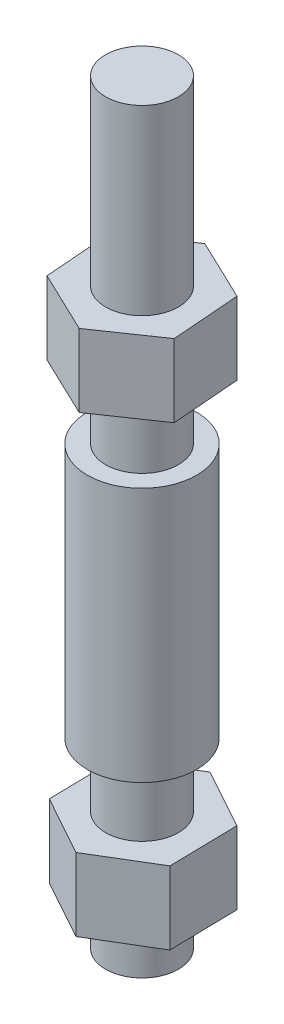
from build123d import *

# Parameters (mm, degrees)
IZIM1_R                     = 4
Y_KSEKLIK_EKSTR_ZYON1_DEPTH = 20
IZIM2_R                     = 6
Y_KSEKLIK_EKSTR_ZYON2_DEPTH = 28
IZIM3_R                     = 4
Y_KSEKLIK_EKSTR_ZYON3_DEPTH = 35
Y_KSEKLIK_EKSTR_ZYON4_START = -5
Y_KSEKLIK_EKSTR_ZYON4_DEPTH = 8
Y_KSEKLIK_EKSTR_ZYON5_START = -20
Y_KSEKLIK_EKSTR_ZYON5_DEPTH = 8


with BuildPart() as part:
    # Çizim1 → Yükseklik-Ekstrüzyon1 (new body)
    with BuildSketch(Plane(origin=(0, 0, 0), x_dir=(1, 0, 0), z_dir=(0, 1, 0))):
        with Locations(Location((0, 0, 0), (0, 0, 270))):
            Circle(IZIM1_R)
    extrude(amount=Y_KSEKLIK_EKSTR_ZYON1_DEPTH)

    # Çizim2 → Yükseklik-Ekstrüzyon2 (add)
    with BuildSketch(Plane(origin=(0, 20, 0), x_dir=(1, 0, 0), z_dir=(0, 1, 0))):
        with Locations(Location((0, 0, 0), (0, 0, 270))):
            Circle(IZIM2_R)
    extrude(amount=Y_KSEKLIK_EKSTR_ZYON2_DEPTH)

    # Çizim3 → Yükseklik-Ekstrüzyon3 (add)
    with BuildSketch(Plane(origin=(0, 48, 0), x_dir=(1, 0, 0), z_dir=(0, 1, 0))):
        with Locations(Location((0, 0, 0), (0, 0, 270))):
            Circle(IZIM3_R)
    extrude(amount=Y_KSEKLIK_EKSTR_ZYON3_DEPTH)

    # Çizim4 → Yükseklik-Ekstrüzyon4 (add)
    with BuildSketch(Plane.XZ.offset(Y_KSEKLIK_EKSTR_ZYON4_START)):
        Polygon((-6.308264839, 3.872314527), (-6.447035908, -3.631955985), (-0.017532542, -7.504270512), (6.550741893, -3.872314527), (6.689512962, 3.631955985), (0.260009596, 7.504270512), align=None)
    extrude(amount=-Y_KSEKLIK_EKSTR_ZYON4_DEPTH)

    # Çizim5 → Yükseklik-Ekstrüzyon5 (add)
    with BuildSketch(Plane(origin=(0, 83, 0), x_dir=(1, 0, 0), z_dir=(0, 1, 0)).offset(Y_KSEKLIK_EKSTR_ZYON5_START)):
        Polygon((6.773389455, -3.23334635), (6.186854806, 4.249254163), (-0.586534649, 7.482600513), (-6.773389455, 3.23334635), (-6.186854806, -4.249254163), (0.586534649, -7.482600513), align=None)
    extrude(amount=-Y_KSEKLIK_EKSTR_ZYON5_DEPTH)


solid = part.part
